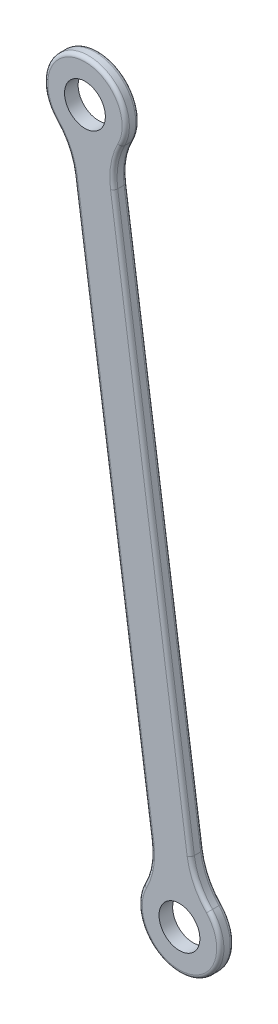
from build123d import *

# Parameters (mm, degrees)
SKETCH2_R           = 4.5
BOSS_EXTRUDE1_DEPTH = 1.5
FILLET2_R           = 15
FILLET1_R           = 0.8


with BuildPart() as part:
    # Sketch2 → Boss-Extrude1 (new, symmetric)
    with BuildSketch(Plane.XY):
        with BuildLine():
            Line((1.274716536, 220.943357999), (19.912187432, 89.850027402))
            ThreePointArc((19.912187432, 89.850027402), (17.820843773, 72.589598754), (11.001786186, 88.583240273))
            Line((11.001786186, 88.583240273), (-7.635684711, 219.67657087))
            ThreePointArc((-7.635684711, 219.67657087), (-5.544341051, 236.936999518), (1.274716536, 220.943357999))
        make_face()
        with Locations((-4.277553922, 228.026598272)):
            Circle(SKETCH2_R, mode=Mode.SUBTRACT)
        with Locations((16.554056644, 81.5)):
            Circle(SKETCH2_R, mode=Mode.SUBTRACT)
    extrude(amount=BOSS_EXTRUDE1_DEPTH, both=True)

    # Fillet2
    fillet2_edges = [part.edges().sort_by_distance(p)[0] for p in [
        (-7.635684711, 219.67657087, 0),
        (1.274716536, 220.943357999, 0),
        (19.912187432, 89.850027402, 0),
        (11.001786186, 88.583240273, 0),
    ]]
    fillet(fillet2_edges, radius=FILLET2_R)

    # Fillet1
    fillet1_edges = [part.edges().sort_by_distance(p)[0] for p in [
        (-5.544341051, 236.936999518, -1.5),
        (-5.544341051, 236.936999518, 1.5),
        (10.593451984, 155.396692701, -1.5),
        (10.593451984, 155.396692701, 1.5),
        (17.820843773, 72.589598754, -1.5),
        (17.820843773, 72.589598754, 1.5),
        (1.683050738, 154.129905572, -1.5),
        (1.683050738, 154.129905572, 1.5),
        (2.213746014, 219.456683126, -1.5),
        (2.213746014, 219.456683126, 1.5),
        (20.399664536, 91.539507977, -1.5),
        (20.399664536, 91.539507977, 1.5),
        (10.062756708, 90.069915146, -1.5),
        (10.062756708, 90.069915146, 1.5),
        (-8.123161814, 217.987090295, -1.5),
        (-8.123161814, 217.987090295, 1.5),
    ]]
    fillet(fillet1_edges, radius=FILLET1_R)


solid = part.part
